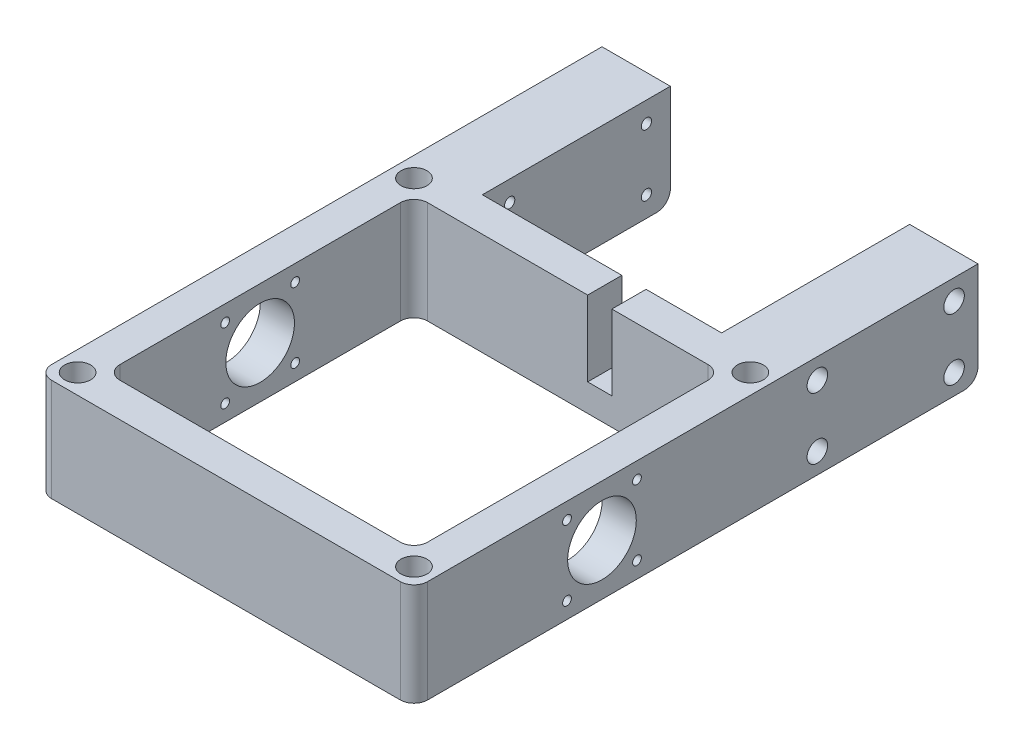
from build123d import *

# Parameters (mm, degrees)
SKETCH1_W           = 25.4
SKETCH1_H           = 69.85
SKETCH1_R           = 4.826
SKETCH1_W_2         = 114.3
SKETCH1_H_2         = 114.3
BOSS_EXTRUDE2_DEPTH = 38.1
CUT_EXTRUDE1_REACH  = 203.206
SKETCH5_R           = 1.63195
SKETCH5_R_2         = 12.75
SKETCH7_W           = 12.7
SKETCH7_H           = 27.94
CUT_EXTRUDE2_DEPTH  = 4.5
CUT_EXTRUDE3_REACH  = 203.206
SKETCH10_R          = 1.905
SKETCH10_3_R        = 3.81
SKETCH10_3_R_2      = 1.905
CUT_EXTRUDE4_DEPTH  = 15.24
CUT_EXTRUDE5_START  = -15.24
SKETCH11_R          = 3.81
CUT_EXTRUDE5_DEPTH  = 15.24
FILLET10_R          = 5.08
FILLET11_R          = 5.08
FILLET12_R          = 5.08
FILLET13_R          = 5.08
FILLET14_R          = 5.08
FILLET15_R          = 5.08
FILLET16_R          = 5.08


with BuildPart() as part:
    # Sketch1 → Boss-Extrude2 (new body)
    # profile 1 of 3: a face of its own
    with BuildSketch(Plane(origin=(0, 0, 0), x_dir=(1, 0, 0), z_dir=(0, 1, 0))):
        with Locations((-57.15, 104.775)):
            Rectangle(SKETCH1_W, SKETCH1_H)
    # profile 2 of 3: a face of its own
    with BuildSketch(Plane(origin=(0, 0, 0), x_dir=(1, 0, 0), z_dir=(0, 1, 0))):
        Polygon((-44.45, 69.85), (-69.85, 69.85), (-69.85, -69.85), (69.85, -69.85), (69.85, 69.85), (44.45, 69.85), (-31.75, 69.85), align=None)
        with Locations(Location((-62.484, -62.484, 0), (0, 0, 90))):
            Circle(SKETCH1_R, mode=Mode.SUBTRACT)
        Rectangle(SKETCH1_W_2, SKETCH1_H_2, mode=Mode.SUBTRACT)
        with Locations(Location((62.484, -62.484, 0), (0, 0, 90))):
            Circle(SKETCH1_R, mode=Mode.SUBTRACT)
        with Locations(Location((-62.484, 62.484, 0), (0, 0, 90))):
            Circle(SKETCH1_R, mode=Mode.SUBTRACT)
        with Locations(Location((62.484, 62.484, 0), (0, 0, 90))):
            Circle(SKETCH1_R, mode=Mode.SUBTRACT)
    # profile 3 of 3: a face of its own
    with BuildSketch(Plane(origin=(0, 0, 0), x_dir=(1, 0, 0), z_dir=(0, 1, 0))):
        with Locations((57.15, 104.775)):
            Rectangle(SKETCH1_W, SKETCH1_H)
    extrude(amount=BOSS_EXTRUDE2_DEPTH)

    # Cut-Extrude1: up to this face of the body (flat: up to its plane)
    cut_extrude1_end = Plane(part.part.faces().sort_by_distance((-69.85, 19.05, -34.925))[0])
    # Sketch5 → Cut-Extrude1 (cut, up to the picked face)
    with BuildSketch(Plane(origin=(69.85, 0, 0), x_dir=(0, 0, -1), z_dir=(1, 0, 0)), mode=Mode.PRIVATE) as cut_extrude1_sk1:
        with Locations((-13, 32.05)):
            Circle(SKETCH5_R)
    cut_extrude1_tool1 = split(extrude(cut_extrude1_sk1.sketch, amount=-CUT_EXTRUDE1_REACH, mode=Mode.PRIVATE), bisect_by=cut_extrude1_end, keep=Keep.BOTH, mode=Mode.PRIVATE)
    # Sketch5 → Cut-Extrude1 (cut, up to the picked face)
    with BuildSketch(Plane(origin=(69.85, 0, 0), x_dir=(0, 0, -1), z_dir=(1, 0, 0)), mode=Mode.PRIVATE) as cut_extrude1_sk2:
        with Locations((13, 6.05)):
            Circle(SKETCH5_R)
    cut_extrude1_tool2 = split(extrude(cut_extrude1_sk2.sketch, amount=-CUT_EXTRUDE1_REACH, mode=Mode.PRIVATE), bisect_by=cut_extrude1_end, keep=Keep.BOTH, mode=Mode.PRIVATE)
    # Sketch5 → Cut-Extrude1 (cut, up to the picked face)
    with BuildSketch(Plane(origin=(69.85, 0, 0), x_dir=(0, 0, -1), z_dir=(1, 0, 0)), mode=Mode.PRIVATE) as cut_extrude1_sk3:
        with Locations((-13, 6.05)):
            Circle(SKETCH5_R)
    cut_extrude1_tool3 = split(extrude(cut_extrude1_sk3.sketch, amount=-CUT_EXTRUDE1_REACH, mode=Mode.PRIVATE), bisect_by=cut_extrude1_end, keep=Keep.BOTH, mode=Mode.PRIVATE)
    # Sketch5 → Cut-Extrude1 (cut, up to the picked face)
    with BuildSketch(Plane(origin=(69.85, 0, 0), x_dir=(0, 0, -1), z_dir=(1, 0, 0)), mode=Mode.PRIVATE) as cut_extrude1_sk4:
        with Locations((13, 32.05)):
            Circle(SKETCH5_R)
    cut_extrude1_tool4 = split(extrude(cut_extrude1_sk4.sketch, amount=-CUT_EXTRUDE1_REACH, mode=Mode.PRIVATE), bisect_by=cut_extrude1_end, keep=Keep.BOTH, mode=Mode.PRIVATE)
    # Sketch5 → Cut-Extrude1 (cut, up to the picked face)
    with BuildSketch(Plane(origin=(69.85, 0, 0), x_dir=(0, 0, -1), z_dir=(1, 0, 0)), mode=Mode.PRIVATE) as cut_extrude1_sk5:
        with Locations((0, 19.05)):
            Circle(SKETCH5_R_2)
    cut_extrude1_tool5 = split(extrude(cut_extrude1_sk5.sketch, amount=-CUT_EXTRUDE1_REACH, mode=Mode.PRIVATE), bisect_by=cut_extrude1_end, keep=Keep.BOTH, mode=Mode.PRIVATE)
    add(cut_extrude1_tool1.solids().sort_by(Axis((69.85, 32.05, 13), (-1, 0, 0)))[0], mode=Mode.SUBTRACT)
    add(cut_extrude1_tool2.solids().sort_by(Axis((69.85, 6.05, -13), (-1, 0, 0)))[0], mode=Mode.SUBTRACT)
    add(cut_extrude1_tool3.solids().sort_by(Axis((69.85, 6.05, 13), (-1, 0, 0)))[0], mode=Mode.SUBTRACT)
    add(cut_extrude1_tool4.solids().sort_by(Axis((69.85, 32.05, -13), (-1, 0, 0)))[0], mode=Mode.SUBTRACT)
    add(cut_extrude1_tool5.solids().sort_by(Axis((69.85, 19.05, 0), (-1, 0, 0)))[0], mode=Mode.SUBTRACT)

    # Sketch7 → Cut-Extrude2 (cut, symmetric)
    with BuildSketch(Plane.ZY.offset(-11.879999989)):
        with Locations((-63.5, 24.13)):
            Rectangle(SKETCH7_W, SKETCH7_H)
    extrude(amount=CUT_EXTRUDE2_DEPTH, both=True, mode=Mode.SUBTRACT)

    # Cut-Extrude3: up to this face of the body (flat: up to its plane)
    cut_extrude3_end = Plane(part.part.faces().sort_by_distance((-69.85, 19.05, -37.47957558))[0])
    # Sketch10 → Cut-Extrude3 (cut, up to the picked face)
    with BuildSketch(Plane(origin=(69.85, 0, 0), x_dir=(0, 0, -1), z_dir=(1, 0, 0)), mode=Mode.PRIVATE) as cut_extrude3_sk1:
        with Locations((80.01, 30.48)):
            Circle(SKETCH10_R)
    cut_extrude3_tool1 = split(extrude(cut_extrude3_sk1.sketch, amount=-CUT_EXTRUDE3_REACH, mode=Mode.PRIVATE), bisect_by=cut_extrude3_end, keep=Keep.BOTH, mode=Mode.PRIVATE)
    # Sketch10 → Cut-Extrude3 (cut, up to the picked face)
    with BuildSketch(Plane(origin=(69.85, 0, 0), x_dir=(0, 0, -1), z_dir=(1, 0, 0)), mode=Mode.PRIVATE) as cut_extrude3_sk2:
        with Locations((80.01, 7.62)):
            Circle(SKETCH10_R)
    cut_extrude3_tool2 = split(extrude(cut_extrude3_sk2.sketch, amount=-CUT_EXTRUDE3_REACH, mode=Mode.PRIVATE), bisect_by=cut_extrude3_end, keep=Keep.BOTH, mode=Mode.PRIVATE)
    # Sketch10 → Cut-Extrude3 (cut, up to the picked face)
    with BuildSketch(Plane(origin=(69.85, 0, 0), x_dir=(0, 0, -1), z_dir=(1, 0, 0)), mode=Mode.PRIVATE) as cut_extrude3_sk3:
        with Locations((130.81, 30.48)):
            Circle(SKETCH10_R)
    cut_extrude3_tool3 = split(extrude(cut_extrude3_sk3.sketch, amount=-CUT_EXTRUDE3_REACH, mode=Mode.PRIVATE), bisect_by=cut_extrude3_end, keep=Keep.BOTH, mode=Mode.PRIVATE)
    # Sketch10 → Cut-Extrude3 (cut, up to the picked face)
    with BuildSketch(Plane(origin=(69.85, 0, 0), x_dir=(0, 0, -1), z_dir=(1, 0, 0)), mode=Mode.PRIVATE) as cut_extrude3_sk4:
        with Locations((130.81, 7.62)):
            Circle(SKETCH10_R)
    cut_extrude3_tool4 = split(extrude(cut_extrude3_sk4.sketch, amount=-CUT_EXTRUDE3_REACH, mode=Mode.PRIVATE), bisect_by=cut_extrude3_end, keep=Keep.BOTH, mode=Mode.PRIVATE)
    add(cut_extrude3_tool1.solids().sort_by(Axis((69.85, 30.48, -80.01), (-1, 0, 0)))[0], mode=Mode.SUBTRACT)
    add(cut_extrude3_tool2.solids().sort_by(Axis((69.85, 7.62, -80.01), (-1, 0, 0)))[0], mode=Mode.SUBTRACT)
    add(cut_extrude3_tool3.solids().sort_by(Axis((69.85, 30.48, -130.81), (-1, 0, 0)))[0], mode=Mode.SUBTRACT)
    add(cut_extrude3_tool4.solids().sort_by(Axis((69.85, 7.62, -130.81), (-1, 0, 0)))[0], mode=Mode.SUBTRACT)

    # Sketch10<3> → Cut-Extrude4 (cut)
    # profile 1 of 4: a face of its own
    with BuildSketch(Plane(origin=(69.85, 0, 0), x_dir=(0, 0, -1), z_dir=(1, 0, 0))):
        with Locations((80.01, 30.48)):
            Circle(SKETCH10_3_R)
        with Locations((80.01, 30.48)):
            Circle(SKETCH10_3_R_2, mode=Mode.SUBTRACT)
    # profile 2 of 4: a face of its own
    with BuildSketch(Plane(origin=(69.85, 0, 0), x_dir=(0, 0, -1), z_dir=(1, 0, 0))):
        with Locations((130.81, 7.62)):
            Circle(SKETCH10_3_R)
        with Locations((130.81, 7.62)):
            Circle(SKETCH10_3_R_2, mode=Mode.SUBTRACT)
    # profile 3 of 4: a face of its own
    with BuildSketch(Plane(origin=(69.85, 0, 0), x_dir=(0, 0, -1), z_dir=(1, 0, 0))):
        with Locations((130.81, 30.48)):
            Circle(SKETCH10_3_R)
        with Locations((130.81, 30.48)):
            Circle(SKETCH10_3_R_2, mode=Mode.SUBTRACT)
    # profile 4 of 4: a face of its own
    with BuildSketch(Plane(origin=(69.85, 0, 0), x_dir=(0, 0, -1), z_dir=(1, 0, 0))):
        with Locations((80.01, 7.62)):
            Circle(SKETCH10_3_R)
        with Locations((80.01, 7.62)):
            Circle(SKETCH10_3_R_2, mode=Mode.SUBTRACT)
    extrude(amount=-CUT_EXTRUDE4_DEPTH, mode=Mode.SUBTRACT)

    # Sketch11 → Cut-Extrude5 (cut)
    with BuildSketch(Plane.ZY.offset(69.85).offset(CUT_EXTRUDE5_START)):
        with Locations(Location((-130.81, 30.48, 0), (0, 0, 180))):
            Circle(SKETCH11_R)
        with Locations(Location((-80.01, 7.62, 0), (0, 0, 180))):
            Circle(SKETCH11_R)
        with Locations(Location((-80.01, 30.48, 0), (0, 0, 180))):
            Circle(SKETCH11_R)
        with Locations(Location((-130.81, 7.62, 0), (0, 0, 180))):
            Circle(SKETCH11_R)
    extrude(amount=CUT_EXTRUDE5_DEPTH, mode=Mode.SUBTRACT)

    # Fillet10
    fillet10_edges = [part.edges().sort_by_distance(p)[0] for p in [
        (57.15, 19.05, -57.15),
    ]]
    fillet(fillet10_edges, radius=FILLET10_R)

    # Fillet11
    fillet11_edges = [part.edges().sort_by_distance(p)[0] for p in [
        (-57.15, 19.05, -57.15),
    ]]
    fillet(fillet11_edges, radius=FILLET11_R)

    # Fillet12
    fillet12_edges = [part.edges().sort_by_distance(p)[0] for p in [
        (-57.15, 19.05, 57.15),
    ]]
    fillet(fillet12_edges, radius=FILLET12_R)

    # Fillet13
    fillet13_edges = [part.edges().sort_by_distance(p)[0] for p in [
        (57.15, 19.05, 57.15),
    ]]
    fillet(fillet13_edges, radius=FILLET13_R)

    # Fillet14
    fillet14_edges = [part.edges().sort_by_distance(p)[0] for p in [
        (-57.15, 0, -139.7),
        (57.15, 0, -139.7),
    ]]
    fillet(fillet14_edges, radius=FILLET14_R)

    # Fillet15
    fillet15_edges = [part.edges().sort_by_distance(p)[0] for p in [
        (-69.85, 19.05, 69.85),
    ]]
    fillet(fillet15_edges, radius=FILLET15_R)

    # Fillet16
    fillet16_edges = [part.edges().sort_by_distance(p)[0] for p in [
        (69.85, 19.05, 69.85),
    ]]
    fillet(fillet16_edges, radius=FILLET16_R)


solid = part.part
